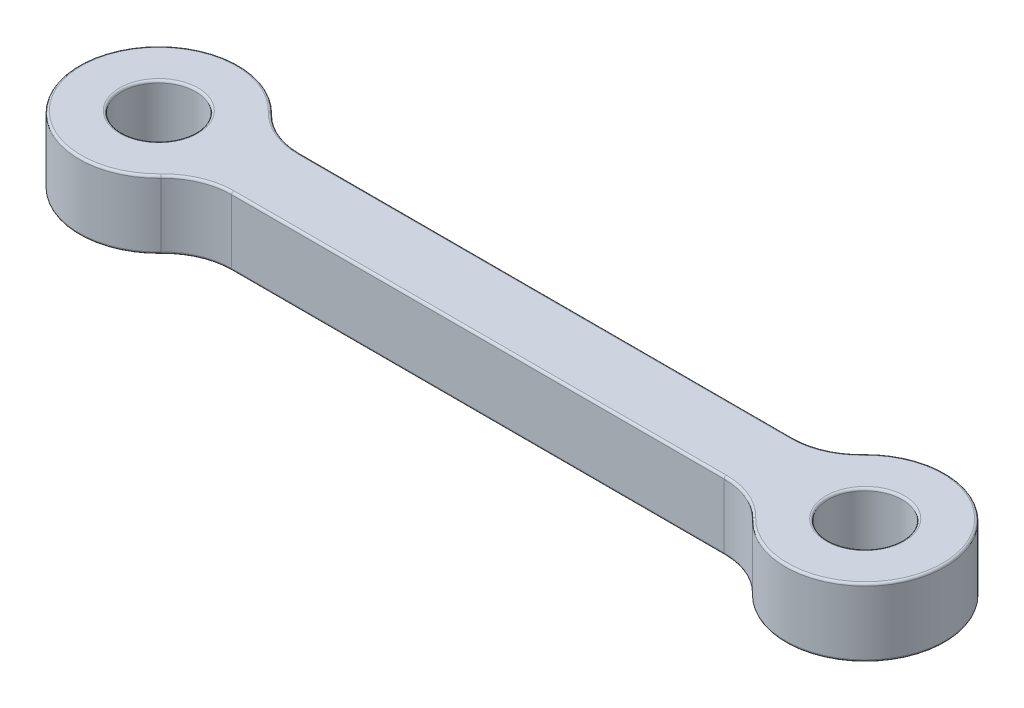
from build123d import *

# Parameters (mm, degrees)
SKETCH1_R           = 1.625
BOSS_EXTRUDE1_DEPTH = 3
FILLET1_R           = 0.1
L_EK1_SCALE         = 2


with BuildPart() as part:
    # Sketch1 → Boss-Extrude1 (new body)
    with BuildSketch(Plane(origin=(0, 0, 0), x_dir=(1, 0, 0), z_dir=(0, 1, 0))):
        with BuildLine():
            Line((4.69041576, 1.5), (26.30958424, 1.5))
            ThreePointArc((26.30958424, 1.5), (27.486281051, 1.740401367), (28.474391514, 2.423076923))
            ThreePointArc((28.474391514, 2.423076923), (34.5, 0), (28.474391514, -2.423076923))
            ThreePointArc((28.474391514, -2.423076923), (27.486281051, -1.740401367), (26.30958424, -1.5))
            Line((26.30958424, -1.5), (4.69041576, -1.5))
            ThreePointArc((4.69041576, -1.5), (3.513718949, -1.740401367), (2.525608486, -2.423076923))
            ThreePointArc((2.525608486, -2.423076923), (-3.5, 0), (2.525608486, 2.423076923))
            ThreePointArc((2.525608486, 2.423076923), (3.513718949, 1.740401367), (4.69041576, 1.5))
        make_face()
        with Locations(Location((0, 0, 0), (0, 0, 270))):
            Circle(SKETCH1_R, mode=Mode.SUBTRACT)
        with Locations(Location((31, 0, 0), (0, 0, 270))):
            Circle(SKETCH1_R, mode=Mode.SUBTRACT)
    extrude(amount=BOSS_EXTRUDE1_DEPTH)

    # Fillet1
    fillet1_edges = [part.edges().sort_by_distance(p)[0] for p in [
        (27.486281051, 0, -1.740401367),
        (34.5, 0, 0),
        (31, 3, -1.625),
        (27.486281051, 0, 1.740401367),
        (15.5, 0, 1.5),
        (3.513718949, 0, 1.740401367),
        (-3.5, 0, 0),
        (3.513718949, 0, -1.740401367),
        (15.5, 0, -1.5),
        (31, 0, -1.625),
        (0, 0, -1.625),
        (15.5, 3, -1.5),
        (3.513718949, 3, -1.740401367),
        (-3.5, 3, 0),
        (3.513718949, 3, 1.740401367),
        (15.5, 3, 1.5),
        (27.486281051, 3, 1.740401367),
        (34.5, 3, 0),
        (27.486281051, 3, -1.740401367),
        (0, 3, -1.625),
    ]]
    fillet(fillet1_edges, radius=FILLET1_R)


with BuildPart() as part_1:
    # Ölçek1: scaled about (15.5, 1.5, 0)
    add(part.part.scale(L_EK1_SCALE).moved(Location((-15.5, -1.5, 0))))


solid = part_1.part
